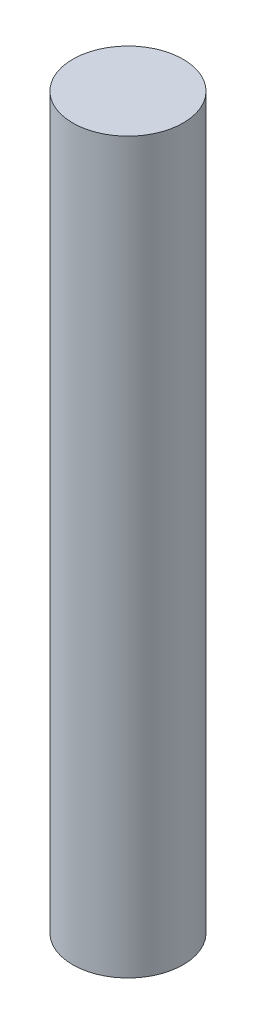
from build123d import *

# Parameters (mm, degrees)
SKETCH1_R           = 25
BOSS_EXTRUDE1_DEPTH = 330


with BuildPart() as part:
    # Sketch1 → Boss-Extrude1 (new body)
    with BuildSketch(Plane(origin=(0, 0, 0), x_dir=(1, 0, 0), z_dir=(0, 1, 0))):
        with Locations(Location((0, 0, 0), (0, 0, 270))):
            Circle(SKETCH1_R)
    extrude(amount=BOSS_EXTRUDE1_DEPTH)


solid = part.part
